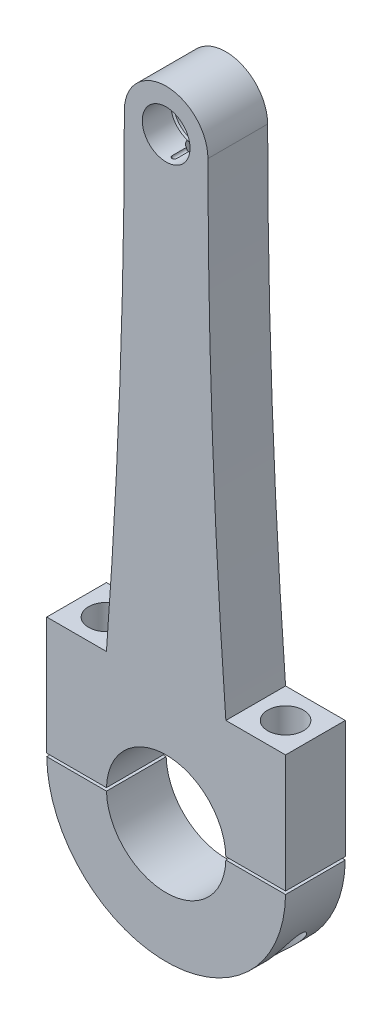
from build123d import *

# Parameters (mm, degrees)
SKETCH1_R                           = 4
BOSS_EXTRUDE1_DEPTH                 = 10
BOSS_EXTRUDE1_2_DEPTH               = 10
SKETCH2_R                           = 3
SKETCH2_R_2                         = 2.5
CUT_EXTRUDE1_DEPTH                  = 19.75
SKETCH2_2_R                         = 2.5
CUT_EXTRUDE2_DEPTH                  = 90.827612681
CUT_EXTRUDE3_REACH                  = 101.544
CUT_EXTRUDE3_END_RADIUS             = 4
SKETCH3_R                           = 1.25
CUT_EXTRUDE3_DIRECTION_2_REACH      = 101.544
CUT_EXTRUDE3_DIRECTION_2_END_RADIUS = 10


with BuildPart() as part:
    # Sketch1 → Boss-Extrude1 (new body)
    with BuildSketch(Plane.XY):
        with BuildLine():
            Line((-20, 0.25), (-20, 20))
            Line((-20, 20), (-10, 20))
            ThreePointArc((-10, 20), (-7.750263487, 59.971884881), (-7, 100))
            ThreePointArc((-7, 100), (0, 107), (7, 100))
            ThreePointArc((7, 100), (7.750263487, 59.971884881), (10, 20))
            Line((10, 20), (20, 20))
            Line((20, 20), (20, 0.25))
            Line((20, 0.25), (9.996874512, 0.25))
            ThreePointArc((9.996874512, 0.25), (0, 10), (-9.996874512, 0.25))
            Line((-9.996874512, 0.25), (-20, 0.25))
        make_face()
        with Locations((0, 100)):
            Circle(SKETCH1_R, mode=Mode.SUBTRACT)
    extrude(amount=BOSS_EXTRUDE1_DEPTH)

    # Sketch2 → Cut-Extrude1 (cut)
    # profile 1 of 2: a face of its own
    with BuildSketch(Plane(origin=(0, 20, 0), x_dir=(1, 0, 0), z_dir=(0, 1, 0))):
        with Locations(Location((15, -5, 0), (0, 0, 270))):
            Circle(SKETCH2_R)
        with Locations(Location((15, -5, 0), (0, 0, 270))):
            Circle(SKETCH2_R_2, mode=Mode.SUBTRACT)
    # profile 2 of 2: a face of its own
    with BuildSketch(Plane(origin=(0, 20, 0), x_dir=(1, 0, 0), z_dir=(0, 1, 0))):
        with Locations(Location((-15, -5, 0), (0, 0, 90))):
            Circle(SKETCH2_R)
        with Locations(Location((-15, -5, 0), (0, 0, 90))):
            Circle(SKETCH2_R_2, mode=Mode.SUBTRACT)
    extrude(amount=-CUT_EXTRUDE1_DEPTH, mode=Mode.SUBTRACT)


with BuildPart() as body_2:
    # Sketch1 → Boss-Extrude1 2 (new body)
    with BuildSketch(Plane.XY):
        with BuildLine():
            Line((-19.998437439, -0.25), (-9.996874512, -0.25))
            ThreePointArc((-9.996874512, -0.25), (0, -10), (9.996874512, -0.25))
            Line((9.996874512, -0.25), (19.998437439, -0.25))
            ThreePointArc((19.998437439, -0.25), (0, -20), (-19.998437439, -0.25))
        make_face()
    extrude(amount=BOSS_EXTRUDE1_2_DEPTH)


with BuildPart() as cut_extrude1_piece_1:
    # of the separate pieces the step leaves, piece 1, a body of its own (cut_extrude1_pieces)
    add(part.part.solids().sort_by_distance((-9.996874512, 0.25, 0))[0])

    # Cut-Extrude3: up to this cylinder (the profile starts outside it)
    cut_extrude3_end = Plane(origin=(0, 100, 5), z_dir=(0, 0, -1)) * Cylinder(CUT_EXTRUDE3_END_RADIUS, 212.088, mode=Mode.PRIVATE)
    # Sketch3 → Cut-Extrude3 (cut, up to the surface)
    with BuildSketch(Plane(origin=(0, 10, 0), x_dir=(-1, 0, 0), z_dir=(0, -1, 0)), mode=Mode.PRIVATE) as cut_extrude3_sk1:
        with Locations(Location((0, -5, 0), (0, 0, 90))):
            Circle(SKETCH3_R)
    cut_extrude3_tool1 = extrude(cut_extrude3_sk1.sketch, amount=-CUT_EXTRUDE3_REACH, mode=Mode.PRIVATE) - cut_extrude3_end
    add(cut_extrude3_tool1.solids().sort_by_distance((0, 10, 5))[0], mode=Mode.SUBTRACT)

    # Cut-Extrude3 direction 2: up to this cylinder (the profile starts outside it)
    cut_extrude3_direction_2_end = Plane(origin=(0, 0, 5), z_dir=(0, 0, -1)) * Cylinder(CUT_EXTRUDE3_DIRECTION_2_END_RADIUS, 224.088, mode=Mode.PRIVATE)
    # Sketch3 → Cut-Extrude3 direction 2 (cut, up to the surface)
    with BuildSketch(Plane(origin=(0, 10, 0), x_dir=(-1, 0, 0), z_dir=(0, -1, 0)), mode=Mode.PRIVATE) as cut_extrude3_direction_2_sk1:
        with Locations(Location((0, -5, 0), (0, 0, 90))):
            Circle(SKETCH3_R)
    cut_extrude3_direction_2_tool1 = extrude(cut_extrude3_direction_2_sk1.sketch, amount=CUT_EXTRUDE3_DIRECTION_2_REACH, mode=Mode.PRIVATE) - cut_extrude3_direction_2_end
    add(cut_extrude3_direction_2_tool1.solids().sort_by_distance((0, 10, 5))[0], mode=Mode.SUBTRACT)
    add(cut_extrude3_direction_2_tool1.solids().sort_by_distance((0, 10, 5))[1], mode=Mode.SUBTRACT)

    # Sketch5 → Cut-Revolve1 (revolve, cut)
    with BuildSketch(Plane(origin=(0, 0, 0), x_dir=(0, 0, -1), z_dir=(1, 0, 0))):
        with BuildLine():
            Line((-5, 95.6), (-5.230940108, 96))
            Line((-5.230940108, 96), (-9, 96))
            ThreePointArc((-9, 96), (-8.882842712, 95.717157288), (-8.6, 95.6))
            Line((-8.6, 95.6), (-5, 95.6))
        make_face()
        with BuildLine():
            ThreePointArc((-1.4, 95.6), (-1.117157288, 95.717157288), (-1, 96))
            Line((-1, 96), (-4.769059892, 96))
            Line((-4.769059892, 96), (-5, 95.6))
            Line((-5, 95.6), (-1.4, 95.6))
        make_face()
    revolve(axis=Axis((0, 96, 10), (0, 0, -1)), mode=Mode.SUBTRACT)

    # Sketch5<5> → Cut-Revolve2 (revolve, cut)
    with BuildSketch(Plane(origin=(0, 0, 0), x_dir=(0, 0, -1), z_dir=(1, 0, 0)), mode=Mode.PRIVATE) as cut_revolve2_sk:
        Polygon((-5, 95.6), (-4.769059892, 96), (-5.230940108, 96), align=None)
    revolve(cut_revolve2_sk.sketch.rotate(Axis((0, 100, 10), (0, 0, -1)), 17.88577553), axis=Axis((0, 100, 10), (0, 0, -1)), mode=Mode.SUBTRACT)


with BuildPart() as cut_extrude1_piece_2:
    # of the separate pieces the step leaves, piece 2, a body of its own (cut_extrude1_pieces)
    add(part.part.solids().sort_by_distance((-15, 0.25, 2.5))[0])


with BuildPart() as cut_extrude1_piece_3:
    # of the separate pieces the step leaves, piece 3, a body of its own (cut_extrude1_pieces)
    add(part.part.solids().sort_by_distance((15, 0.25, 7.5))[0])


with BuildPart() as cut_extrude2_tool:
    # Sketch2<2> → Cut-Extrude2 (new, through all)
    with BuildSketch(Plane(origin=(0, 20, 0), x_dir=(1, 0, 0), z_dir=(0, 1, 0))):
        with Locations(Location((-15, -5, 0), (0, 0, 270))):
            Circle(SKETCH2_2_R)
        with Locations(Location((15, -5, 0), (0, 0, 270))):
            Circle(SKETCH2_2_R)
    extrude(amount=-CUT_EXTRUDE2_DEPTH)


with BuildPart() as body_2_1:
    add(body_2.part)

    # Cut-Extrude2: cut by cut_extrude2_tool
    add(cut_extrude2_tool.part, mode=Mode.SUBTRACT)


with BuildPart() as cut_extrude1_piece_2_1:
    add(cut_extrude1_piece_2.part)

    # Cut-Extrude2: cut by cut_extrude2_tool
    add(cut_extrude2_tool.part, mode=Mode.SUBTRACT)


with BuildPart() as cut_extrude1_piece_3_1:
    add(cut_extrude1_piece_3.part)

    # Cut-Extrude2: cut by cut_extrude2_tool
    add(cut_extrude2_tool.part, mode=Mode.SUBTRACT)


solid = Compound([cut_extrude1_piece_1.part, body_2_1.part])
